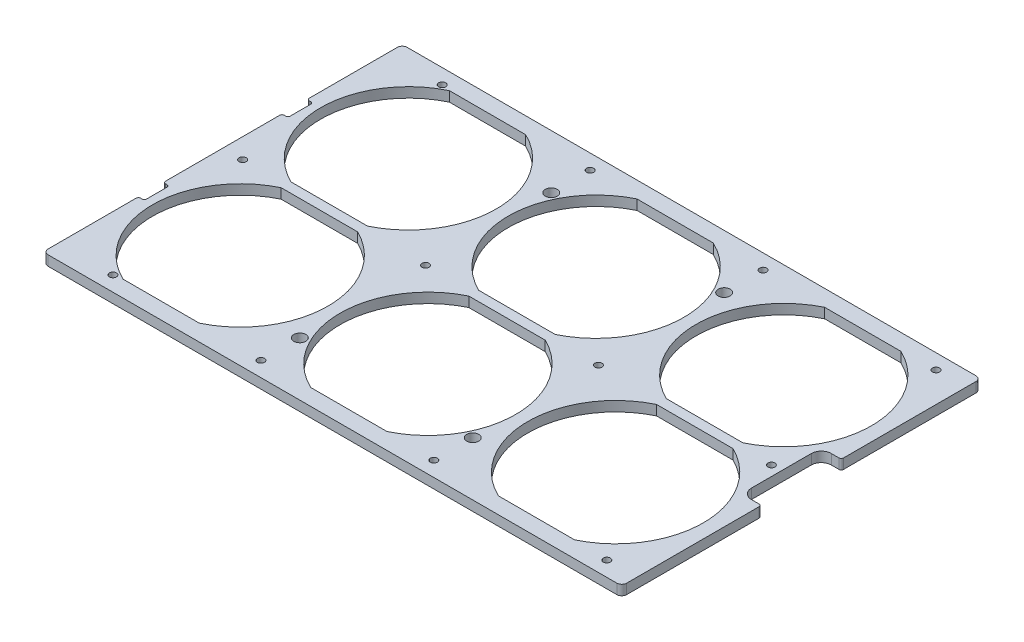
from build123d import *

# Parameters (mm, degrees)
SKETCH1_R               = 2.2479
SKETCH1_R_2             = 3.81
BOSS_EXTRUDE1_DEPTH     = 6.35
CUT_EXTRUDE1_DEPTH      = 217.831812703
CUT_EXTRUDE1_DEPTH_BACK = 217.831812703
SKETCH3_W               = 3.81
SKETCH3_H               = 15.875
CUT_EXTRUDE2_DEPTH      = 217.831812703
FILLET1_R               = 1.524


with BuildPart() as part:
    # Sketch1 → Boss-Extrude1 (new body)
    with BuildSketch(Plane(origin=(0, 0, 0), x_dir=(1, 0, 0), z_dir=(0, 1, 0))):
        with BuildLine():
            Line((-180.975, 114.3), (180.975, 114.3))
            ThreePointArc((180.975, 114.3), (183.22006403, 113.37006403), (184.15, 111.125))
            Line((184.15, 111.125), (184.15, -111.125))
            ThreePointArc((184.15, -111.125), (183.22006403, -113.37006403), (180.975, -114.3))
            Line((180.975, -114.3), (-180.975, -114.3))
            ThreePointArc((-180.975, -114.3), (-183.22006403, -113.37006403), (-184.15, -111.125))
            Line((-184.15, -111.125), (-184.15, 111.125))
            ThreePointArc((-184.15, 111.125), (-183.22006403, 113.37006403), (-180.975, 114.3))
        make_face()
        with Locations(Location((-149.225, -104.775, 0), (0, 0, 270))):
            Circle(SKETCH1_R, mode=Mode.SUBTRACT)
        with Locations(Location((-55.033333333, -104.775, 0), (0, 0, 270))):
            Circle(SKETCH1_R, mode=Mode.SUBTRACT)
        with Locations(Location((55.033333333, -104.775, 0), (0, 0, 270))):
            Circle(SKETCH1_R, mode=Mode.SUBTRACT)
        with Locations(Location((165.1, -104.775, 0), (0, 0, 270))):
            Circle(SKETCH1_R, mode=Mode.SUBTRACT)
        with Locations(Location((165.1, 104.775, 0), (0, 0, 270))):
            Circle(SKETCH1_R, mode=Mode.SUBTRACT)
        with Locations(Location((55.033333333, 104.775, 0), (0, 0, 270))):
            Circle(SKETCH1_R, mode=Mode.SUBTRACT)
        with Locations(Location((-55.033333333, 104.775, 0), (0, 0, 270))):
            Circle(SKETCH1_R, mode=Mode.SUBTRACT)
        with Locations(Location((-149.225, 104.775, 0), (0, 0, 270))):
            Circle(SKETCH1_R, mode=Mode.SUBTRACT)
        with Locations(Location((-55.033333333, 0, 0), (0, 0, 270))):
            Circle(SKETCH1_R, mode=Mode.SUBTRACT)
        with Locations(Location((55.033333333, 0, 0), (0, 0, 270))):
            Circle(SKETCH1_R, mode=Mode.SUBTRACT)
        with Locations(Location((-55.0291, 80.01, 0), (0, 0, 270))):
            Circle(SKETCH1_R_2, mode=Mode.SUBTRACT)
        with Locations(Location((-55.0291, -80.01, 0), (0, 0, 270))):
            Circle(SKETCH1_R_2, mode=Mode.SUBTRACT)
        with Locations(Location((55.0291, -80.01, 0), (0, 0, 270))):
            Circle(SKETCH1_R_2, mode=Mode.SUBTRACT)
        with Locations(Location((55.0291, 80.01, 0), (0, 0, 270))):
            Circle(SKETCH1_R_2, mode=Mode.SUBTRACT)
        with Locations(Location((165.1, 0, 0), (0, 0, 270))):
            Circle(SKETCH1_R, mode=Mode.SUBTRACT)
        with Locations(Location((-171.45, 0, 0), (0, 0, 270))):
            Circle(SKETCH1_R, mode=Mode.SUBTRACT)
        with BuildLine():
            Line((-24.3078, -3.1623), (24.3078, -3.1623))
            ThreePointArc((24.3078, -3.1623), (55.879209158, -53.5178), (24.3078, -103.8733))
            Line((24.3078, -103.8733), (-24.3078, -103.8733))
            ThreePointArc((-24.3078, -103.8733), (-55.879209158, -53.5178), (-24.3078, -3.1623))
        make_face(mode=Mode.SUBTRACT)
        with BuildLine():
            Line((95.136490842, -3.1623), (143.752090842, -3.1623))
            ThreePointArc((143.752090842, -3.1623), (175.3235, -53.5178), (143.752090842, -103.8733))
            Line((143.752090842, -103.8733), (95.136490842, -103.8733))
            ThreePointArc((95.136490842, -103.8733), (63.565081684, -53.5178), (95.136490842, -3.1623))
        make_face(mode=Mode.SUBTRACT)
        with BuildLine():
            Line((-143.752090842, -3.1623), (-95.136490842, -3.1623))
            ThreePointArc((-95.136490842, -3.1623), (-63.565081684, -53.5178), (-95.136490842, -103.8733))
            Line((-95.136490842, -103.8733), (-143.752090842, -103.8733))
            ThreePointArc((-143.752090842, -103.8733), (-175.3235, -53.5178), (-143.752090842, -3.1623))
        make_face(mode=Mode.SUBTRACT)
        with BuildLine():
            Line((-24.3078, 103.8733), (24.3078, 103.8733))
            ThreePointArc((24.3078, 103.8733), (55.879209158, 53.5178), (24.3078, 3.1623))
            Line((24.3078, 3.1623), (-24.3078, 3.1623))
            ThreePointArc((-24.3078, 3.1623), (-55.879209158, 53.5178), (-24.3078, 103.8733))
        make_face(mode=Mode.SUBTRACT)
        with BuildLine():
            Line((-143.752090842, 103.8733), (-95.136490842, 103.8733))
            ThreePointArc((-95.136490842, 103.8733), (-63.565081684, 53.5178), (-95.136490842, 3.1623))
            Line((-95.136490842, 3.1623), (-143.752090842, 3.1623))
            ThreePointArc((-143.752090842, 3.1623), (-175.3235, 53.5178), (-143.752090842, 103.8733))
        make_face(mode=Mode.SUBTRACT)
        with BuildLine():
            Line((95.136490842, 103.8733), (143.752090842, 103.8733))
            ThreePointArc((143.752090842, 103.8733), (175.3235, 53.5178), (143.752090842, 3.1623))
            Line((143.752090842, 3.1623), (95.136490842, 3.1623))
            ThreePointArc((95.136490842, 3.1623), (63.565081684, 53.5178), (95.136490842, 103.8733))
        make_face(mode=Mode.SUBTRACT)
    extrude(amount=BOSS_EXTRUDE1_DEPTH)

    # Sketch2 → Cut-Extrude1 (cut, two sides: drawn at the far end of the back side and taken through both)
    with BuildSketch(Plane(origin=(0, 6.35, 0), x_dir=(1, 0, 0), z_dir=(0, 1, 0)).offset(-CUT_EXTRUDE1_DEPTH_BACK)):
        with BuildLine():
            Line((184.15, 25.4), (177.8, 25.4))
            ThreePointArc((177.8, 25.4), (173.309871939, 23.540128061), (171.45, 19.05))
            Line((171.45, 19.05), (171.45, -19.05))
            ThreePointArc((171.45, -19.05), (173.309871939, -23.540128061), (177.8, -25.4))
            Line((177.8, -25.4), (184.15, -25.4))
            Line((184.15, -25.4), (184.15, 25.4))
        make_face()
    extrude(amount=CUT_EXTRUDE1_DEPTH + CUT_EXTRUDE1_DEPTH_BACK, mode=Mode.SUBTRACT)

    # Sketch3 → Cut-Extrude2 (cut, through all)
    with BuildSketch(Plane(origin=(0, 6.35, 0), x_dir=(1, 0, 0), z_dir=(0, 1, 0))):
        with Locations((-182.245, 45.72)):
            Rectangle(SKETCH3_W, SKETCH3_H)
        with Locations((-182.245, -45.72)):
            Rectangle(SKETCH3_W, SKETCH3_H)
    extrude(amount=-CUT_EXTRUDE2_DEPTH, mode=Mode.SUBTRACT)

    # Fillet1
    fillet1_edges = [part.edges().sort_by_distance(p)[0] for p in [
        (184.15, 3.175, -25.4),
        (184.15, 3.175, 25.4),
        (-184.15, 3.175, -37.7825),
        (-184.15, 3.175, -53.6575),
        (-180.34, 3.175, -53.6575),
        (-180.34, 3.175, -37.7825),
        (-184.15, 3.175, 53.6575),
        (-184.15, 3.175, 37.7825),
        (-180.34, 3.175, 37.7825),
        (-180.34, 3.175, 53.6575),
    ]]
    fillet(fillet1_edges, radius=FILLET1_R)


solid = part.part
